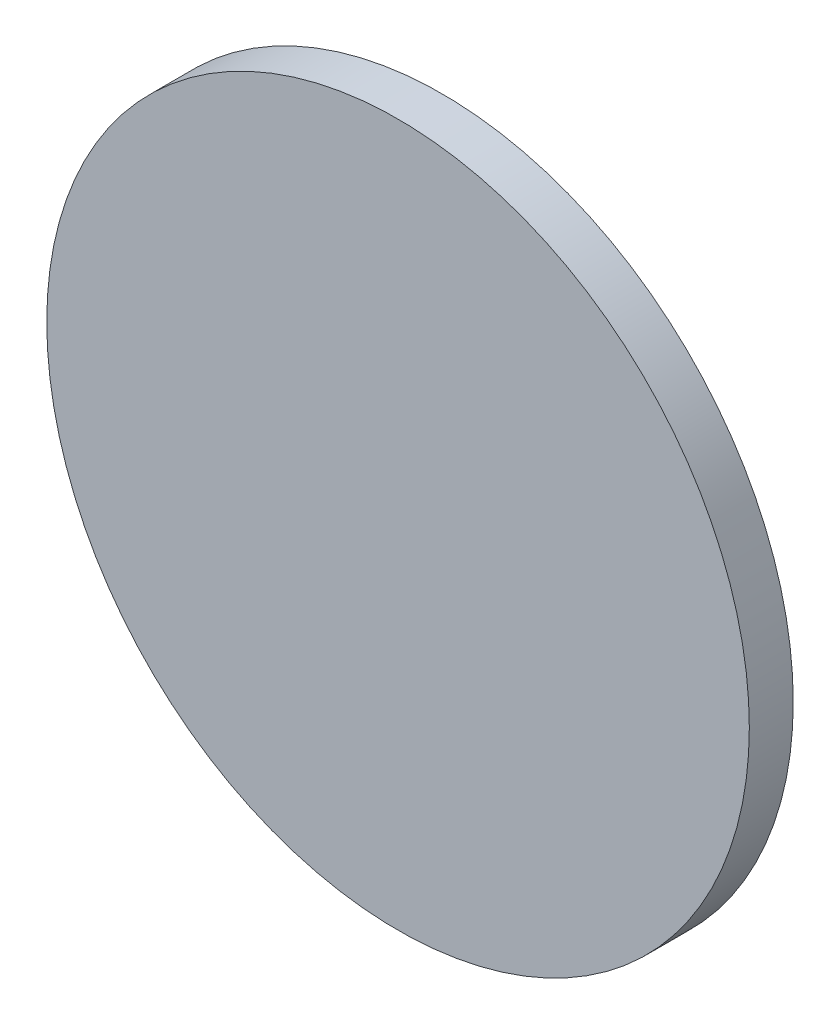
from build123d import *

# Parameters (mm, degrees)
SKETCH1_R           = 50.8
BOSS_EXTRUDE1_DEPTH = 6.35


with BuildPart() as part:
    # Sketch1 → Boss-Extrude1 (new body)
    with BuildSketch(Plane.XY):
        Circle(SKETCH1_R)
    extrude(amount=BOSS_EXTRUDE1_DEPTH)


solid = part.part
